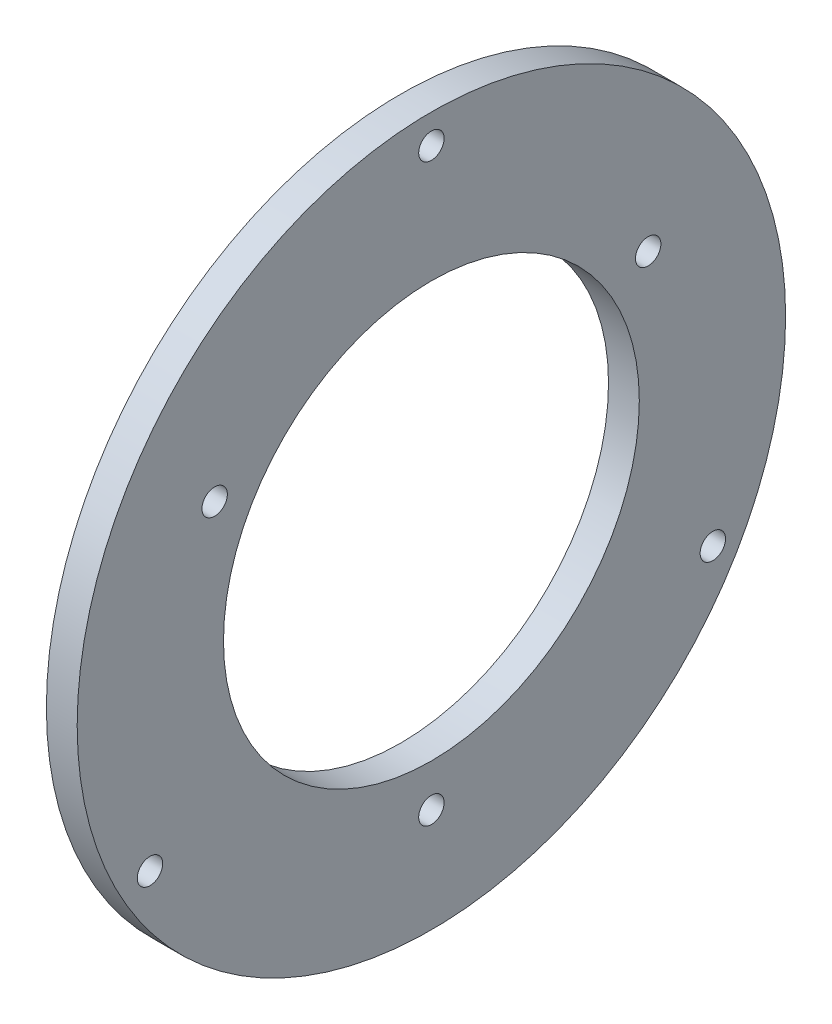
from build123d import *

# Parameters (mm, degrees)
AXIAL_PROFILE_MM_W     = 4
AXIAL_PROFILE_MM_H     = 19
AXIAL_HOLES_DEPTH      = 151.487507787
AXIAL_HOLES_DEPTH_BACK = 151.487507787
SKETCH2_R              = 1.65


with BuildPart() as part:
    # Axial profile (mm) → Full revolution (revolve)
    with BuildSketch(Plane.XY, mode=Mode.PRIVATE) as full_revolution_sk:
        with Locations((133.7, 36.5)):
            Rectangle(AXIAL_PROFILE_MM_W, AXIAL_PROFILE_MM_H)
    revolve(full_revolution_sk.sketch.rotate(Axis((-110, 0, 0), (1, 0, 0)), 90), axis=Axis((-110, 0, 0), (1, 0, 0)))

    # Sketch2 → Axial holes (cut, two sides: drawn at the far end of the back side and taken through both)
    with BuildSketch(Plane(origin=(0, 0, 0), x_dir=(0, 0, -1), z_dir=(1, 0, 0)).offset(-AXIAL_HOLES_DEPTH_BACK)):
        with Locations((0, 42.2)):
            Circle(SKETCH2_R)
        with Locations((-36.54627204, -21.1)):
            Circle(SKETCH2_R)
        with Locations((36.54627204, -21.1)):
            Circle(SKETCH2_R)
        with Locations((-28.145825623, 16.25)):
            Circle(SKETCH2_R)
        with Locations((0, -32.5)):
            Circle(SKETCH2_R)
        with Locations((28.145825623, 16.25)):
            Circle(SKETCH2_R)
    extrude(amount=AXIAL_HOLES_DEPTH + AXIAL_HOLES_DEPTH_BACK, mode=Mode.SUBTRACT)


solid = part.part
